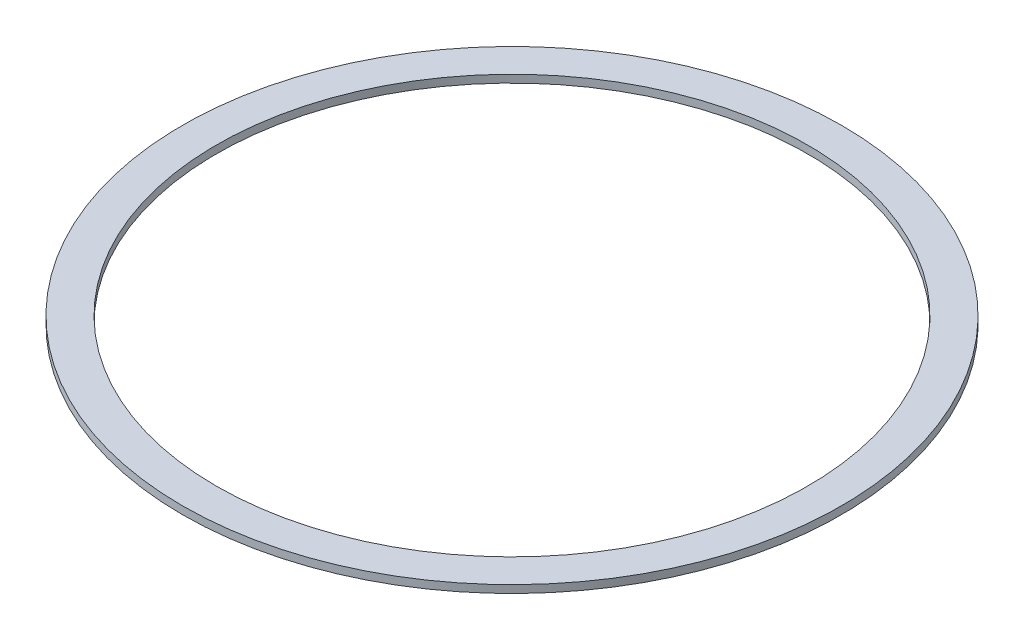
from build123d import *

# Parameters (mm, degrees)
SKETCH1_R           = 135.75
SKETCH1_R_2         = 121.75
BOSS_EXTRUDE1_DEPTH = 3.175


with BuildPart() as part:
    # Sketch1 → Boss-Extrude1 (new body)
    with BuildSketch(Plane(origin=(0, 0, 0), x_dir=(1, 0, 0), z_dir=(0, 1, 0))):
        Circle(SKETCH1_R)
        Circle(SKETCH1_R_2, mode=Mode.SUBTRACT)
    extrude(amount=BOSS_EXTRUDE1_DEPTH)


solid = part.part
